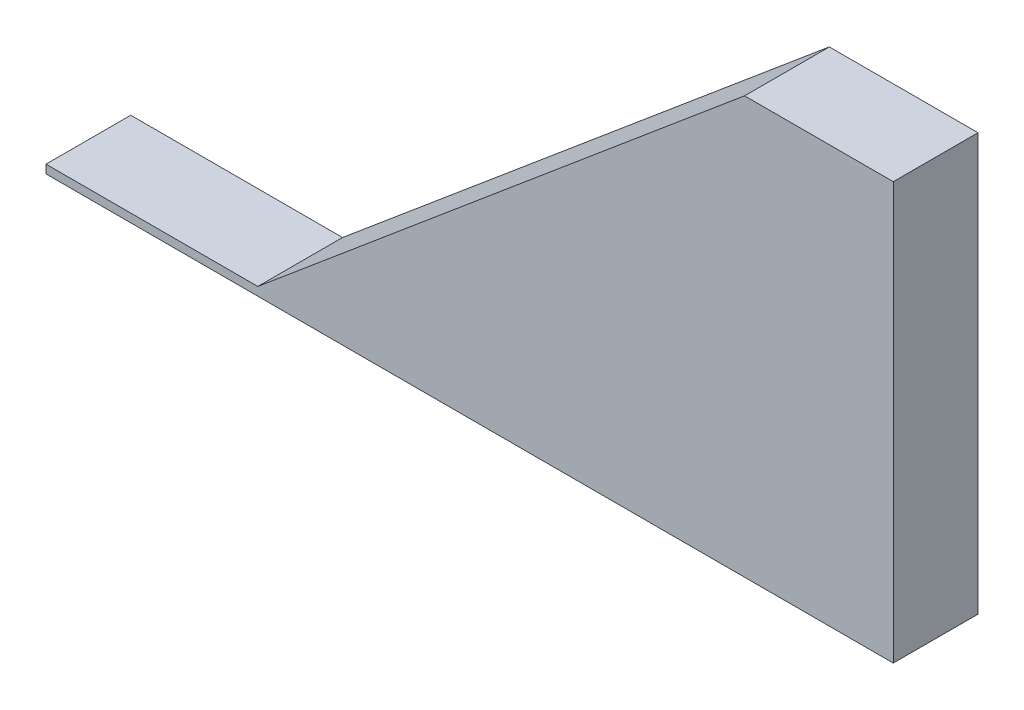
from build123d import *

# Parameters (mm, degrees)
EXTRUDE_1_DEPTH = 200


with BuildPart() as part:
    # 草图1 → 凸台-拉伸1 (new body)
    with BuildSketch(Plane.XY):
        Polygon((318.306542279, 196.432703448), (1467.373206957, 1160.614117978), (1818.306542279, 1160.614117978), (1818.306542279, 196.432703448), (1818.306542279, 176.432703448), (-181.693457721, 176.432703448), (-181.693457721, 196.432703448), align=None)
    extrude(amount=EXTRUDE_1_DEPTH)


solid = part.part
